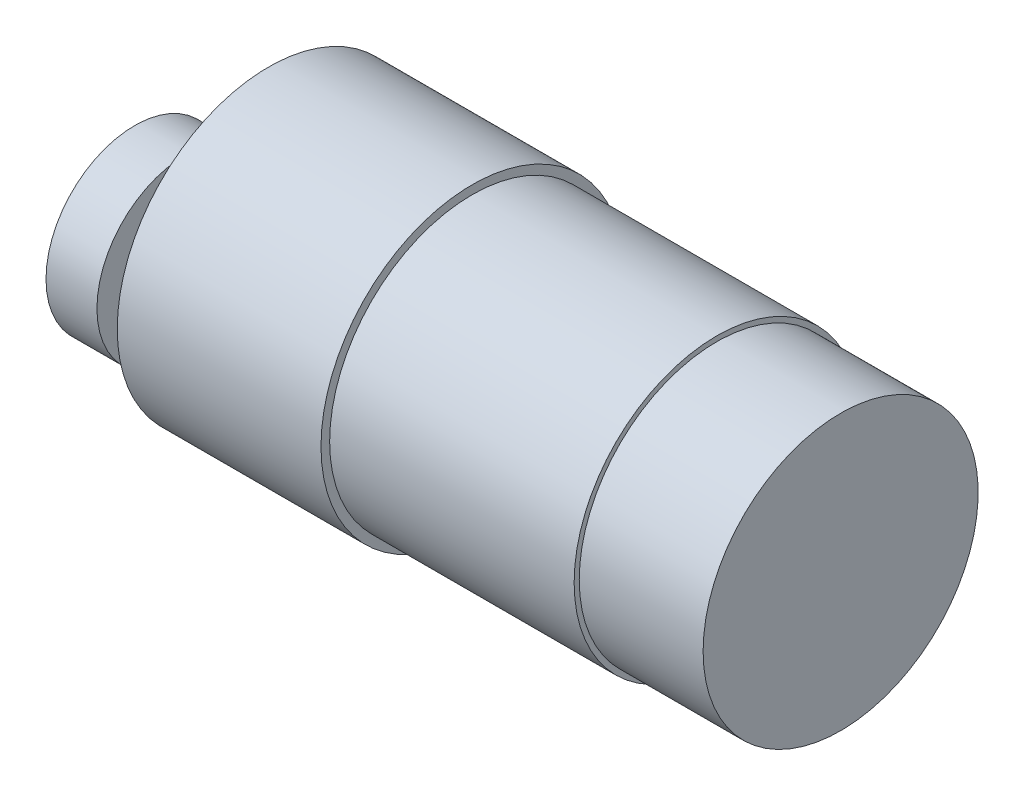
from build123d import *

# Parameters (mm, degrees)
ESQUISSE6_R                                   = 18.8595
BOSS_EXTRU_2_DEPTH                            = 25.4
ESQUISSE7_R                                   = 17.78
BOSS_EXTRU_3_DEPTH                            = 30.48
ESQUISSE8_R                                   = 17.145
BOSS_EXTRU_4_DEPTH                            = 15.4432
ESQUISSE9_R                                   = 5.969
BOSS_EXTRU_5_DEPTH                            = 6.096
ESQUISSE10_R                                  = 4.699
BOSS_EXTRU_6_DEPTH                            = 4.233333333
ESQUISSE11_R                                  = 11.0617
BOSS_EXTRU_7_DEPTH                            = 6.35
ESQUISSE12_R                                  = 4.7752
BOSS_EXTRU_8_DEPTH                            = 3.302
PER_AGE_POUR_TUYAU_POUR_TROU_TARAUD_1_1_D     = 6.1468
PER_AGE_POUR_TUYAU_POUR_TROU_TARAUD_1_1_DEPTH = 19.981333333
BOSS_EXTRU_9_DEPTH                            = 19.981333333
BOSS_EXTRU_10_DEPTH                           = 2.032
ENL_V_MAT_EXTRU_2_REACH                       = 93.955
ESQUISSE18_R                                  = 1.4605
ESQUISSE19_R                                  = 1.5
ESQUISSE19_R_2                                = 1.500000048
ENL_V_MAT_EXTRU_3_DEPTH                       = 5


with BuildPart() as part:
    # Esquisse6 → Boss.-Extru.2 (new body)
    with BuildSketch(Plane(origin=(0, 0, 0), x_dir=(0, 0, -1), z_dir=(1, 0, 0))):
        Circle(ESQUISSE6_R)
    extrude(amount=BOSS_EXTRU_2_DEPTH)

    # Esquisse7 → Boss.-Extru.3 (add)
    with BuildSketch(Plane(origin=(25.4, 0, 0), x_dir=(0, 0, -1), z_dir=(1, 0, 0))):
        with Locations(Location((0, 0, 0), (0, 0, 180))):
            Circle(ESQUISSE7_R)
    extrude(amount=BOSS_EXTRU_3_DEPTH)

    # Esquisse8 → Boss.-Extru.4 (add)
    with BuildSketch(Plane(origin=(55.88, 0, 0), x_dir=(0, 0, -1), z_dir=(1, 0, 0))):
        with Locations(Location((0, 0, 0), (0, 0, 180))):
            Circle(ESQUISSE8_R)
    extrude(amount=BOSS_EXTRU_4_DEPTH)

    # Esquisse9 → Boss.-Extru.5 (add)
    with BuildSketch(Plane.ZY):
        with Locations(Location((0, -6.858, 0), (0, 0, 180))):
            Circle(ESQUISSE9_R)
    extrude(amount=BOSS_EXTRU_5_DEPTH)

    # Esquisse10 → Boss.-Extru.6 (add)
    with BuildSketch(Plane.ZY.offset(6.096)):
        with Locations((0, -6.858)):
            Circle(ESQUISSE10_R)
    extrude(amount=BOSS_EXTRU_6_DEPTH)

    # Esquisse11 → Boss.-Extru.7 (add)
    with BuildSketch(Plane.ZY.offset(10.329333333)):
        with Locations((0, -6.858)):
            Circle(ESQUISSE11_R)
    extrude(amount=BOSS_EXTRU_7_DEPTH)

    # Esquisse12 → Boss.-Extru.8 (add)
    with BuildSketch(Plane.ZY.offset(16.679333333)):
        with Locations(Location((0, -6.858, 0), (0, 0, 180))):
            Circle(ESQUISSE12_R)
    extrude(amount=BOSS_EXTRU_8_DEPTH)

    # Perçage pour tuyau pour trou taraudé 1/161
    with Locations(Plane.ZY.offset(19.981333333)):
        with Locations((0, -6.858)):
            Hole(PER_AGE_POUR_TUYAU_POUR_TROU_TARAUD_1_1_D / 2, depth=PER_AGE_POUR_TUYAU_POUR_TROU_TARAUD_1_1_DEPTH)

    # Esquisse16 → Boss.-Extru.9 (add)
    with BuildSketch(Plane.ZY):
        with BuildLine():
            Line((-1.778, -4.476758467), (1.778, -4.476758467))
            ThreePointArc((1.778, -4.476758467), (0, -9.8298), (-1.778, -4.476758467))
        make_face()
    extrude(amount=BOSS_EXTRU_9_DEPTH)

    # Esquisse17 → Boss.-Extru.10 (add)
    with BuildSketch(Plane.ZY.offset(19.981333333)):
        with BuildLine():
            Line((-1.778, -4.476758467), (1.778, -4.476758467))
            ThreePointArc((1.778, -4.476758467), (0, -9.8298), (-1.778, -4.476758467))
        make_face()
    extrude(amount=BOSS_EXTRU_10_DEPTH)

    # Esquisse18 → Enlèv. mat.-Extru.2 (cut, up to next)
    with BuildSketch(Plane.ZY.offset(16.679333333), mode=Mode.PRIVATE) as enl_v_mat_extru_2_sk1:
        with Locations((0, -0.254)):
            Circle(ESQUISSE18_R)
    enl_v_mat_extru_2_tool1 = extrude(enl_v_mat_extru_2_sk1.sketch, amount=-ENL_V_MAT_EXTRU_2_REACH, mode=Mode.PRIVATE) & part.part
    # Esquisse18 → Enlèv. mat.-Extru.2 (cut, up to next)
    with BuildSketch(Plane.ZY.offset(16.679333333), mode=Mode.PRIVATE) as enl_v_mat_extru_2_sk2:
        with Locations((6.604, -6.858)):
            Circle(ESQUISSE18_R)
    enl_v_mat_extru_2_tool2 = extrude(enl_v_mat_extru_2_sk2.sketch, amount=-ENL_V_MAT_EXTRU_2_REACH, mode=Mode.PRIVATE) & part.part
    # Esquisse18 → Enlèv. mat.-Extru.2 (cut, up to next)
    with BuildSketch(Plane.ZY.offset(16.679333333), mode=Mode.PRIVATE) as enl_v_mat_extru_2_sk3:
        with Locations((0, -13.462)):
            Circle(ESQUISSE18_R)
    enl_v_mat_extru_2_tool3 = extrude(enl_v_mat_extru_2_sk3.sketch, amount=-ENL_V_MAT_EXTRU_2_REACH, mode=Mode.PRIVATE) & part.part
    # Esquisse18 → Enlèv. mat.-Extru.2 (cut, up to next)
    with BuildSketch(Plane.ZY.offset(16.679333333), mode=Mode.PRIVATE) as enl_v_mat_extru_2_sk4:
        with Locations((-6.604, -6.858)):
            Circle(ESQUISSE18_R)
    enl_v_mat_extru_2_tool4 = extrude(enl_v_mat_extru_2_sk4.sketch, amount=-ENL_V_MAT_EXTRU_2_REACH, mode=Mode.PRIVATE) & part.part
    add(enl_v_mat_extru_2_tool1.solids().sort_by_distance((-16.679333, -0.254, 0))[0], mode=Mode.SUBTRACT)
    add(enl_v_mat_extru_2_tool2.solids().sort_by_distance((-16.679333, -6.858, 6.604))[0], mode=Mode.SUBTRACT)
    add(enl_v_mat_extru_2_tool3.solids().sort_by_distance((-16.679333, -13.462, 0))[0], mode=Mode.SUBTRACT)
    add(enl_v_mat_extru_2_tool4.solids().sort_by_distance((-16.679333, -6.858, -6.604))[0], mode=Mode.SUBTRACT)

    # Esquisse19 → Enlèv. mat.-Extru.3 (cut)
    with BuildSketch(Plane.ZY):
        with Locations((6.376248943, 14.789374018)):
            Circle(ESQUISSE19_R)
        with Locations((7.253318149, -15.510625982)):
            Circle(ESQUISSE19_R_2)
        with Locations((-16.809397398, 1.555003695)):
            Circle(ESQUISSE19_R_2)
    extrude(amount=-ENL_V_MAT_EXTRU_3_DEPTH, mode=Mode.SUBTRACT)


solid = part.part
